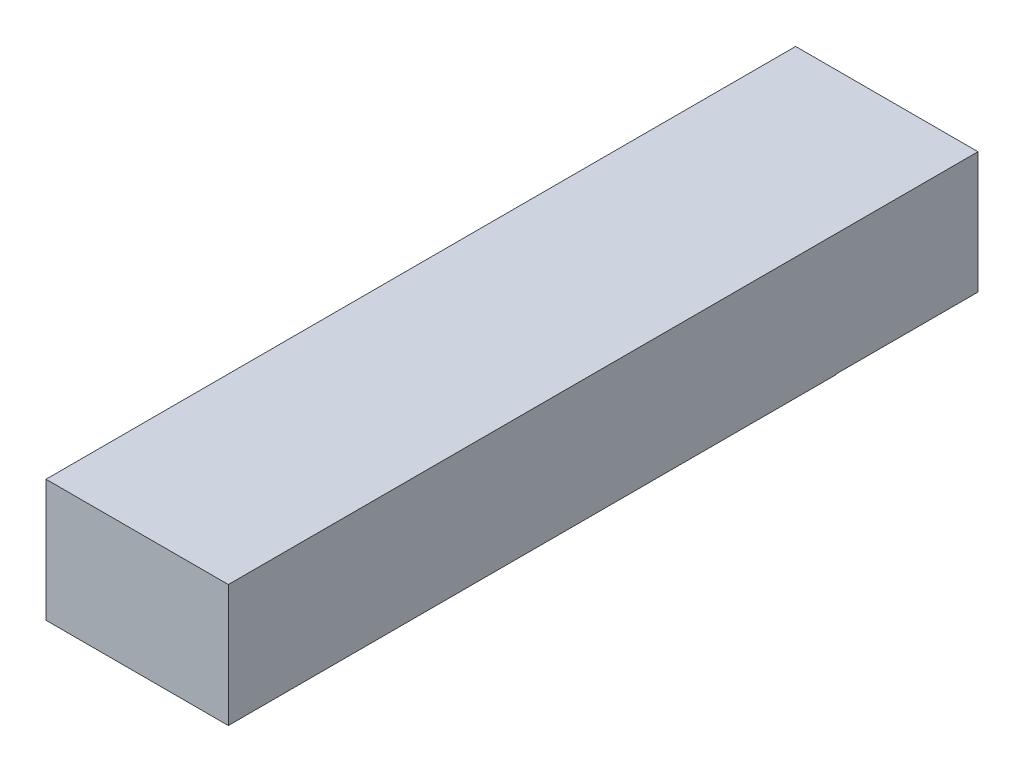
from build123d import *

# Parameters (mm, degrees)
BOSS_EXTRUDE1_DEPTH = 7
SKETCH4_W           = 9
SKETCH4_H           = 6.028682547
BOSS_EXTRUDE2_DEPTH = 30


with BuildPart() as part:
    # Sketch3 → Boss-Extrude1 (new body)
    with BuildSketch(Plane.XY):
        Polygon((-1.2, -2), (-4.5, -2), (-4.5, 4), (4.5, 4), (4.5, -2), (1.2, -2), (1.2, -0.3), (2.8, -0.3), (2.8, 2), (-2.8, 2), (-2.8, -0.3), (-1.2, -0.3), align=None)
    extrude(amount=BOSS_EXTRUDE1_DEPTH)

    # Sketch4 → Boss-Extrude2 (add)
    with BuildSketch(Plane.XY.offset(7)):
        with Locations((0, 0.985658726)):
            Rectangle(SKETCH4_W, SKETCH4_H)
    extrude(amount=BOSS_EXTRUDE2_DEPTH)


solid = part.part
